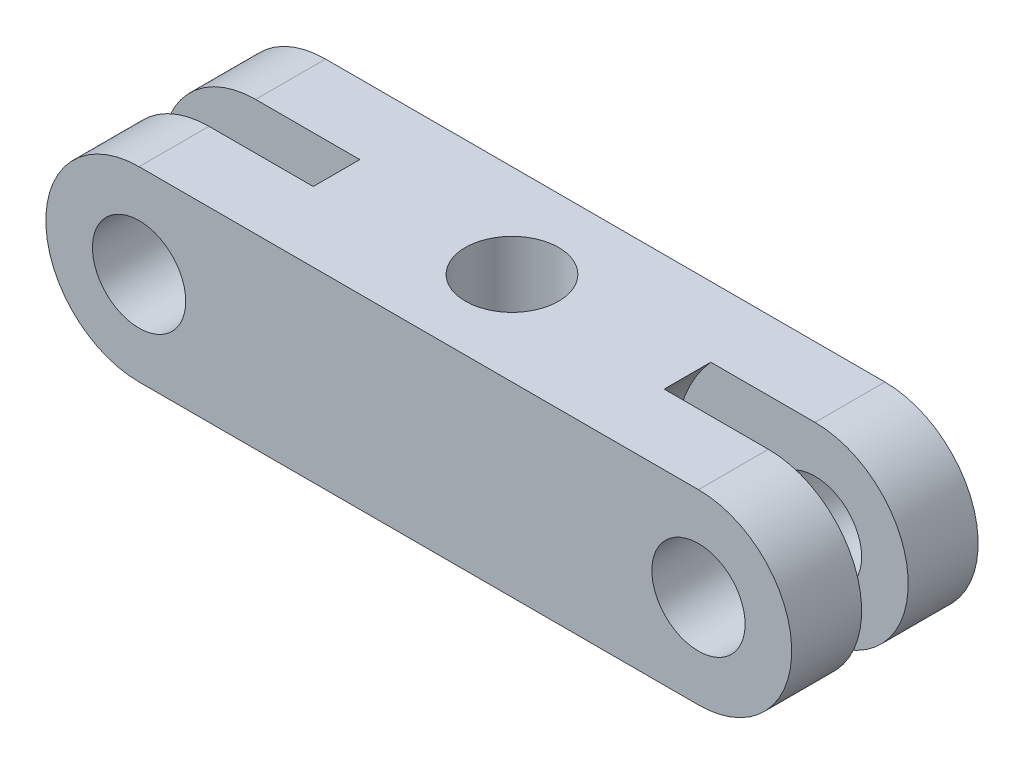
from build123d import *

# Parameters (mm, degrees)
SKETCH1_R           = 5
BOSS_EXTRUDE1_DEPTH = 10
SKETCH3_R           = 15
CUT_EXTRUDE2_DEPTH  = 2.5
SKETCH4_R           = 5
CUT_EXTRUDE3_DEPTH  = 74.484692283


with BuildPart() as part:
    # Sketch1 → Boss-Extrude1 (new, symmetric)
    with BuildSketch(Plane.XY):
        with BuildLine():
            Line((0, 10), (60, 10))
            ThreePointArc((60, 10), (70, 0), (60, -10))
            Line((60, -10), (0, -10))
            ThreePointArc((0, -10), (-10, 0), (0, 10))
        make_face()
        Circle(SKETCH1_R, mode=Mode.SUBTRACT)
        with Locations((60, 0)):
            Circle(SKETCH1_R, mode=Mode.SUBTRACT)
    extrude(amount=BOSS_EXTRUDE1_DEPTH, both=True)

    # Sketch3 → Cut-Extrude2 (cut, symmetric)
    with BuildSketch(Plane.XY):
        Circle(SKETCH3_R)
        with Locations((60, 0)):
            Circle(SKETCH3_R)
    extrude(amount=CUT_EXTRUDE2_DEPTH, both=True, mode=Mode.SUBTRACT)

    # Sketch4 → Cut-Extrude3 (cut, through all)
    with BuildSketch(Plane(origin=(0, 10, 0), x_dir=(1, 0, 0), z_dir=(0, 1, 0))):
        with Locations(Location((30, 0, 0), (0, 0, 270))):
            Circle(SKETCH4_R)
    extrude(amount=-CUT_EXTRUDE3_DEPTH, mode=Mode.SUBTRACT)


solid = part.part
